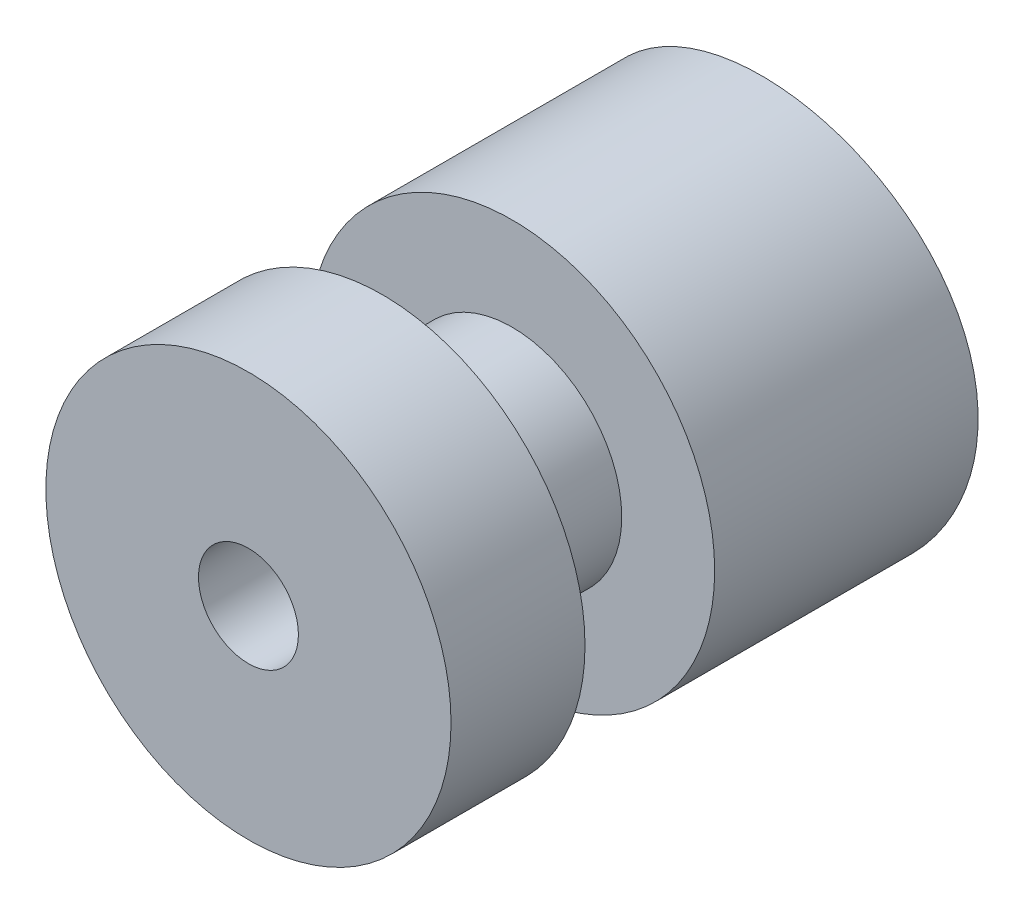
from build123d import *

# Parameters (mm, degrees)
SKETCH1_R           = 9.525
SKETCH1_R_2         = 2.3495
EXTRUDE1_DEPTH      = 24.78278
SKETCH2_OUTSIDE_W   = 28.372
SKETCH2_OUTSIDE_H   = 28.372
SKETCH2_OUTSIDE_R   = 5.1562
EXTRUDE2_DEPTH      = 6.096
EXTRUDE3_DEPTH      = 29.207045831
EXTRUDE3_DEPTH_BACK = 29.207045831


with BuildPart() as part:
    # Sketch1 → Extrude1 (new body)
    with BuildSketch(Plane.XY):
        Circle(SKETCH1_R)
        Circle(SKETCH1_R_2, mode=Mode.SUBTRACT)
    extrude(amount=EXTRUDE1_DEPTH)

    # Sketch2 outside → Extrude2 (cut)
    with BuildSketch(Plane.XY.offset(18.48358)):
        Rectangle(SKETCH2_OUTSIDE_W, SKETCH2_OUTSIDE_H)
        Circle(SKETCH2_OUTSIDE_R, mode=Mode.SUBTRACT)
    extrude(amount=-EXTRUDE2_DEPTH, mode=Mode.SUBTRACT)

    # Sketch3 → Extrude3 (cut, two sides: drawn at the far end of the back side and taken through both)
    with BuildSketch(Plane(origin=(0, 0, 0), x_dir=(1, 0, 0), z_dir=(0, 1, 0)).offset(-EXTRUDE3_DEPTH_BACK)):
        with BuildLine():
            Line((81.364445057, 9.888659405), (9.525, 0))
            ThreePointArc((9.525, 0), (0, -0.652479271), (-9.525, 0))
            Line((-9.525, 0), (-81.364445057, 9.888659405))
            Line((-81.364445057, 9.888659405), (-81.364445057, 154.92233068))
            Line((-81.364445057, 154.92233068), (81.364445057, 154.92233068))
            Line((81.364445057, 154.92233068), (81.364445057, 9.888659405))
        make_face()
    extrude(amount=EXTRUDE3_DEPTH + EXTRUDE3_DEPTH_BACK, mode=Mode.SUBTRACT)


solid = part.part
